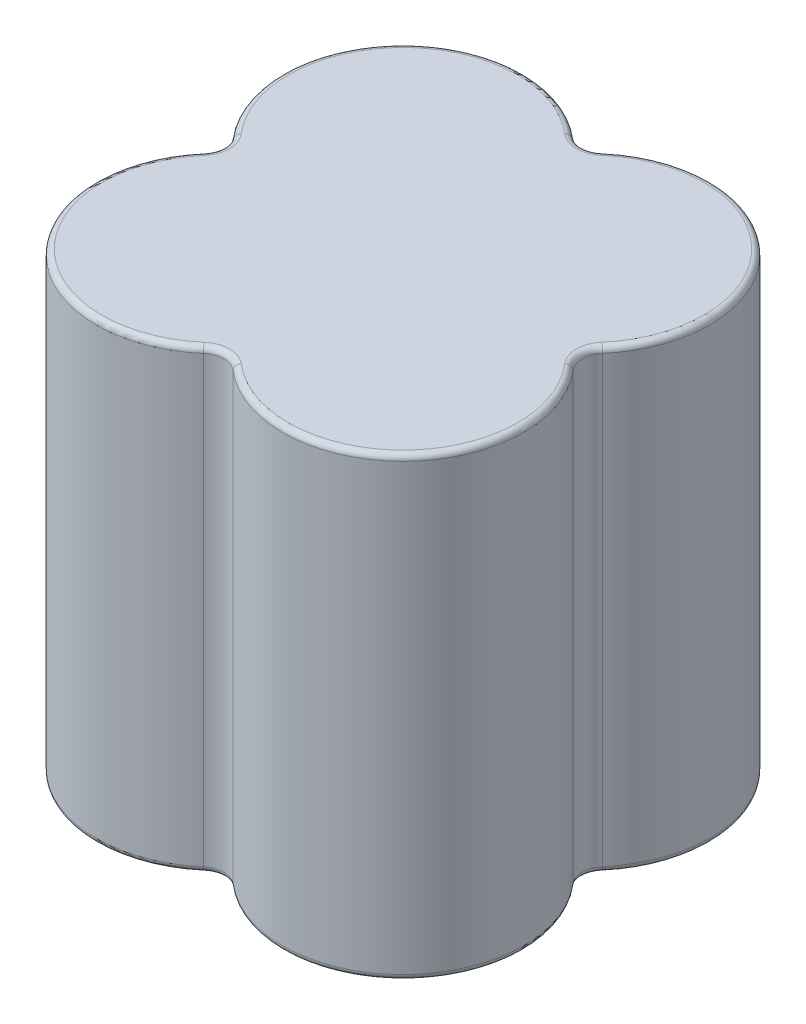
from build123d import *

# Parameters (mm, degrees)
BOSS_EXTRUDE1_DEPTH = 40
FILLET1_R           = 0.5


with BuildPart() as part:
    # Sketch1 → Boss-Extrude1 (new body)
    with BuildSketch(Plane(origin=(0, 0, 0), x_dir=(-1, 0, 0), z_dir=(0, 1, 0))):
        with BuildLine():
            ThreePointArc((-1.297272016, -16.203890569), (-15.648623862, -15.657161397), (-16.203180401, -1.306109879))
            ThreePointArc((-16.203180401, -1.306109879), (-15.721955807, -0.004287594), (-16.203890363, 1.29727203))
            ThreePointArc((-16.203890363, 1.29727203), (-15.657161191, 15.648623877), (-1.306109674, 16.203180415))
            ThreePointArc((-1.306109674, 16.203180415), (-0.004287389, 15.721955821), (1.297272236, 16.203890378))
            ThreePointArc((1.297272236, 16.203890378), (15.648624082, 15.657161206), (16.203180621, 1.306109688))
            ThreePointArc((16.203180621, 1.306109688), (15.721956027, 0.004287403), (16.203890583, -1.297272221))
            ThreePointArc((16.203890583, -1.297272221), (15.657161411, -15.648624068), (1.306109893, -16.203180607))
            ThreePointArc((1.306109893, -16.203180607), (0.004287608, -15.721956013), (-1.297272016, -16.203890569))
        make_face()
    extrude(amount=BOSS_EXTRUDE1_DEPTH)

    # Fillet1
    fillet1_edges = [part.edges().sort_by_distance(p)[0] for p in [
        (-15.648624082, 0, 15.657161206),
        (-15.721956027, 0, 0.004287403),
        (-15.657161411, 0, -15.648624068),
        (-0.004287608, 0, -15.721956013),
        (-15.721956027, 40, 0.004287403),
        (-15.648624082, 40, 15.657161206),
        (0.004287389, 40, 15.721955821),
        (15.657161191, 40, 15.648623877),
        (15.721955807, 40, -0.004287594),
        (15.648623862, 40, -15.657161397),
        (-0.004287608, 40, -15.721956013),
        (15.648623862, 0, -15.657161397),
        (-15.657161411, 40, -15.648624068),
        (15.721955807, 0, -0.004287594),
        (15.657161191, 0, 15.648623877),
        (0.004287389, 0, 15.721955821),
    ]]
    fillet(fillet1_edges, radius=FILLET1_R)


solid = part.part
